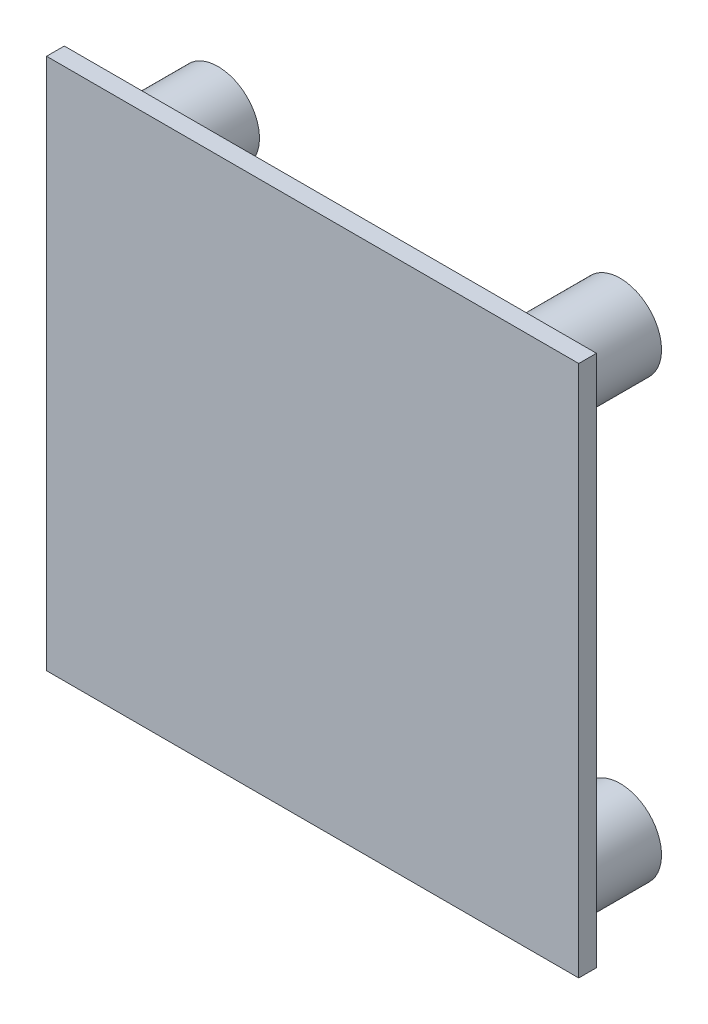
from build123d import *

# Parameters (mm, degrees)
SKETCH_1_W      = 45
SKETCH_1_H      = 45
EXTRUDE_1_DEPTH = 1.5
SKETCH_2_R      = 3.5
SKETCH_2_R_2    = 1.5
EXTRUDE_2_DEPTH = 7


with BuildPart() as part:
    # Эскиз1 → Бобышка-Вытянуть1 (new body)
    with BuildSketch(Plane.XY):
        with Locations((22.5, 22.5)):
            Rectangle(SKETCH_1_W, SKETCH_1_H)
    extrude(amount=EXTRUDE_1_DEPTH)

    # Эскиз2 → Бобышка-Вытянуть2 (add)
    # profile 1 of 4: a face of its own
    with BuildSketch(Plane(origin=(0, 0, 0), x_dir=(-1, 0, 0), z_dir=(0, 0, -1))):
        with Locations((-40, 41)):
            Circle(SKETCH_2_R)
        with Locations((-40, 41)):
            Circle(SKETCH_2_R_2, mode=Mode.SUBTRACT)
    # profile 2 of 4: a face of its own
    with BuildSketch(Plane(origin=(0, 0, 0), x_dir=(-1, 0, 0), z_dir=(0, 0, -1))):
        with Locations((-6, 39.5)):
            Circle(SKETCH_2_R)
        with Locations((-6, 39.5)):
            Circle(SKETCH_2_R_2, mode=Mode.SUBTRACT)
    # profile 3 of 4: a face of its own
    with BuildSketch(Plane(origin=(0, 0, 0), x_dir=(-1, 0, 0), z_dir=(0, 0, -1))):
        with Locations((-40, 4)):
            Circle(SKETCH_2_R)
        with Locations((-40, 4)):
            Circle(SKETCH_2_R_2, mode=Mode.SUBTRACT)
    # profile 4 of 4: a face of its own
    with BuildSketch(Plane(origin=(0, 0, 0), x_dir=(-1, 0, 0), z_dir=(0, 0, -1))):
        with Locations((-6, 6.5)):
            Circle(SKETCH_2_R)
        with Locations((-6, 6.5)):
            Circle(SKETCH_2_R_2, mode=Mode.SUBTRACT)
    extrude(amount=EXTRUDE_2_DEPTH)


solid = part.part
